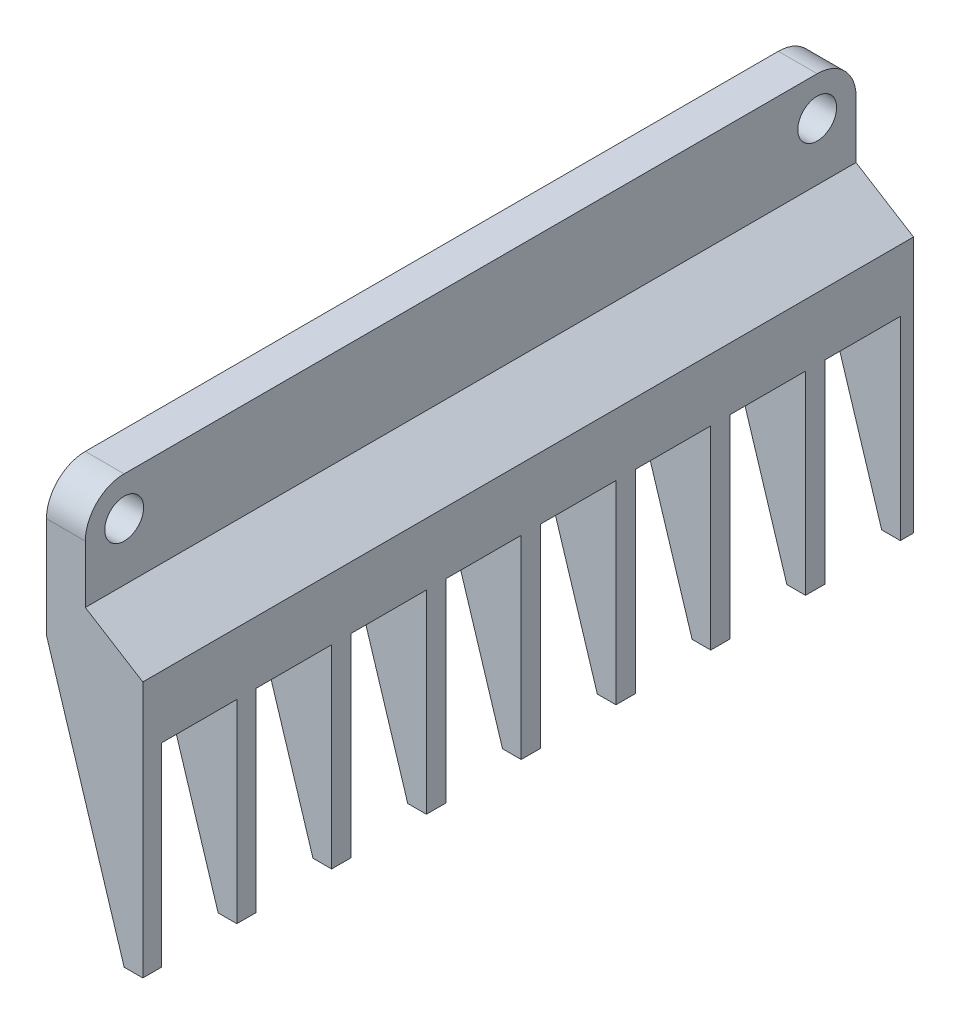
from build123d import *

# Parameters (mm, degrees)
BOSS_EXTRUDE1_DEPTH = 125.984
FILLET1_R           = 6.35
SKETCH6_R           = 3.175
CUT_EXTRUDE2_DEPTH  = 62.992
SKETCH7_W           = 12.319
SKETCH7_H           = 31.75
CUT_EXTRUDE3_DEPTH  = 142.958507177


with BuildPart() as part:
    # Sketch1 → Boss-Extrude1 (new body)
    with BuildSketch(Plane.XY):
        Polygon((0, 0), (3.048, 0), (3.048, 41.91), (-6.35, 47.752), (-6.35, 63.5), (-12.7, 63.5), (-12.7, 40.64), align=None)
    extrude(amount=BOSS_EXTRUDE1_DEPTH)

    # Fillet1
    fillet1_edges = [part.edges().sort_by_distance(p)[0] for p in [
        (-9.525, 63.5, 125.984),
        (-9.525, 63.5, 0),
    ]]
    fillet(fillet1_edges, radius=FILLET1_R)

    # Sketch6 → Cut-Extrude2 (cut, symmetric)
    with BuildSketch(Plane(origin=(-6.35, 0, 0), x_dir=(0, 0, -1), z_dir=(1, 0, 0))):
        with Locations(Location((-119.634, 57.15, 0), (0, 0, 90))):
            Circle(SKETCH6_R)
        with Locations(Location((-6.35, 57.15, 0), (0, 0, 90))):
            Circle(SKETCH6_R)
    extrude(amount=CUT_EXTRUDE2_DEPTH, both=True, mode=Mode.SUBTRACT)

    # Sketch7 → Cut-Extrude3 (cut, through all)
    with BuildSketch(Plane(origin=(3.048, 0, 0), x_dir=(0, 0, -1), z_dir=(1, 0, 0))):
        with Locations((-116.7765, 15.875)):
            Rectangle(SKETCH7_W, SKETCH7_H)
        with Locations((-101.2825, 15.875)):
            Rectangle(SKETCH7_W, SKETCH7_H)
        with Locations((-85.7885, 15.875)):
            Rectangle(SKETCH7_W, SKETCH7_H)
        with Locations((-70.2945, 15.875)):
            Rectangle(SKETCH7_W, SKETCH7_H)
        with Locations((-54.8005, 15.875)):
            Rectangle(SKETCH7_W, SKETCH7_H)
        with Locations((-39.3065, 15.875)):
            Rectangle(SKETCH7_W, SKETCH7_H)
        with Locations((-23.8125, 15.875)):
            Rectangle(SKETCH7_W, SKETCH7_H)
        with Locations((-8.3185, 15.875)):
            Rectangle(SKETCH7_W, SKETCH7_H)
    extrude(amount=-CUT_EXTRUDE3_DEPTH, mode=Mode.SUBTRACT)


solid = part.part
